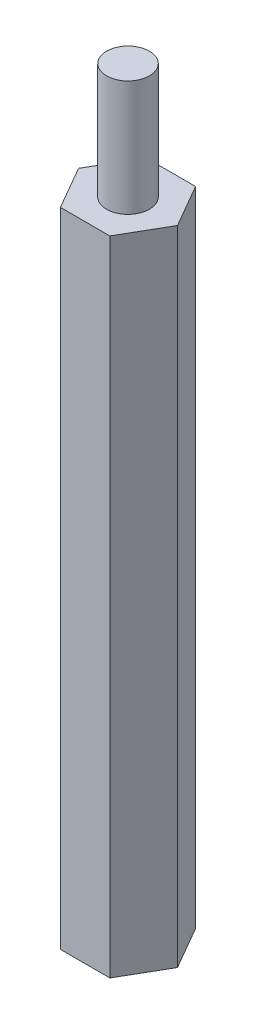
from build123d import *

# Parameters (mm, degrees)
BOSS_EXTRUDE1_DEPTH = 45
SKETCH5_R           = 1.5
BOSS_EXTRUDE2_DEPTH = 8.091605471
SKETCH6_R           = 1.5
CUT_EXTRUDE1_DEPTH  = 4


with BuildPart() as part:
    # Sketch3 → Boss-Extrude1 (new body)
    with BuildSketch(Plane(origin=(0, 0, 0), x_dir=(1, 0, 0), z_dir=(0, 1, 0))):
        Polygon((-3.464101615, 0), (-1.732050808, -3), (1.732050808, -3), (3.464101615, 0), (1.732050808, 3), (-1.732050808, 3), align=None)
    extrude(amount=BOSS_EXTRUDE1_DEPTH)

    # Sketch5 → Boss-Extrude2 (add)
    with BuildSketch(Plane(origin=(0, 45, 0), x_dir=(1, 0, 0), z_dir=(0, 1, 0))):
        with Locations(Location((0, 0, 0), (0, 0, 270))):
            Circle(SKETCH5_R)
    extrude(amount=BOSS_EXTRUDE2_DEPTH)

    # Sketch6 → Cut-Extrude1 (cut)
    with BuildSketch(Plane.XZ):
        with Locations(Location((0, 0, 0), (0, 0, 90))):
            Circle(SKETCH6_R)
    extrude(amount=-CUT_EXTRUDE1_DEPTH, mode=Mode.SUBTRACT)


solid = part.part
